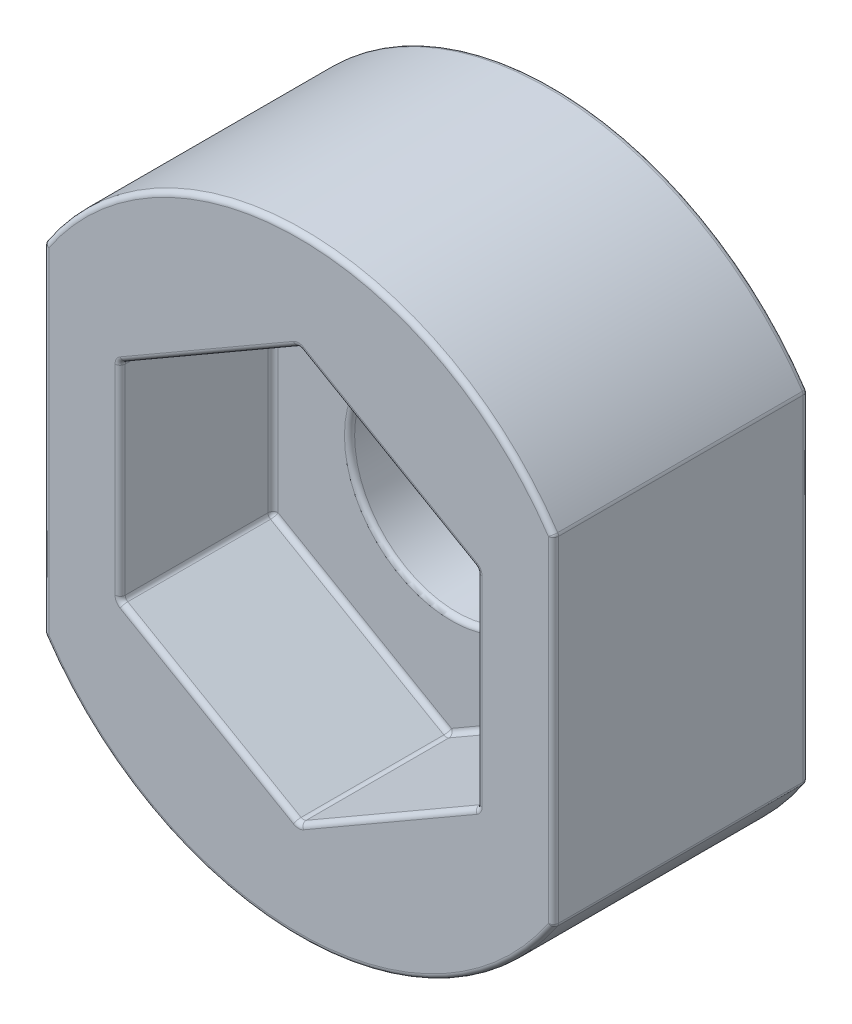
from build123d import *

# Parameters (mm, degrees)
ESQUISSE1_R             = 6
EXTRUSION1_DEPTH        = 5
ENL_V_MAT_EXTRU_1_DEPTH = 3
ESQUISSE3_W             = 3.158529234
ESQUISSE3_H             = 10.681133213
ENL_V_MAT_EXTRU_2_DEPTH = 10.848857802
ESQUISSE4_R             = 2
ENL_V_MAT_EXTRU_3_DEPTH = 9.366600265
CONG_1_R                = 0.1


with BuildPart() as part:
    # Esquisse1 → Extrusion1 (new body)
    with BuildSketch(Plane.XY):
        Circle(ESQUISSE1_R)
    extrude(amount=EXTRUSION1_DEPTH)

    # Esquisse2 → Enlèv. mat.-Extru.1 (cut)
    with BuildSketch(Plane.XY.offset(5)):
        Polygon((0, 4.041451884), (-3.5, 2.020725942), (-3.5, -2.020725942), (0, -4.041451884), (3.5, -2.020725942), (3.5, 2.020725942), align=None)
    extrude(amount=-ENL_V_MAT_EXTRU_1_DEPTH, mode=Mode.SUBTRACT)

    # Esquisse3 → Enlèv. mat.-Extru.2 (cut, through all)
    with BuildSketch(Plane.XY.offset(5)):
        with Locations((-6.579264617, 0.289330923)):
            Rectangle(ESQUISSE3_W, ESQUISSE3_H)
        with Locations((6.579264617, 0.289330923)):
            Rectangle(ESQUISSE3_W, ESQUISSE3_H)
    extrude(amount=-ENL_V_MAT_EXTRU_2_DEPTH, mode=Mode.SUBTRACT)

    # Esquisse4 → Enlèv. mat.-Extru.3 (cut, through all)
    with BuildSketch(Plane.XY.offset(2)):
        Circle(ESQUISSE4_R)
    extrude(amount=-ENL_V_MAT_EXTRU_3_DEPTH, mode=Mode.SUBTRACT)

    # Congé1
    cong_1_edges = [part.edges().sort_by_distance(p)[0] for p in [
        (0, 6, 0),
        (-5, 3.31662479, 2.5),
        (0, 6, 5),
        (5, 3.31662479, 2.5),
        (5, 0, 0),
        (0, -6, 0),
        (-5, 0, 0),
        (-2, 0, 0),
        (-5, 0, 5),
        (-5, -3.31662479, 2.5),
        (5, 0, 5),
        (0, -6, 5),
        (-1.75, 3.031088913, 5),
        (1.75, 3.031088913, 5),
        (-3.5, 0, 5),
        (3.5, 0, 5),
        (-1.75, -3.031088913, 5),
        (1.75, -3.031088913, 5),
        (5, -3.31662479, 2.5),
        (-2, 0, 2),
        (0, 4.041451884, 3.5),
        (-3.5, 2.020725942, 3.5),
        (-1.75, 3.031088913, 2),
        (3.5, 2.020725942, 3.5),
        (1.75, 3.031088913, 2),
        (-3.5, -2.020725942, 3.5),
        (-3.5, 0, 2),
        (3.5, -2.020725942, 3.5),
        (3.5, 0, 2),
        (0, -4.041451884, 3.5),
        (-1.75, -3.031088913, 2),
        (1.75, -3.031088913, 2),
    ]]
    fillet(cong_1_edges, radius=CONG_1_R)


solid = part.part
